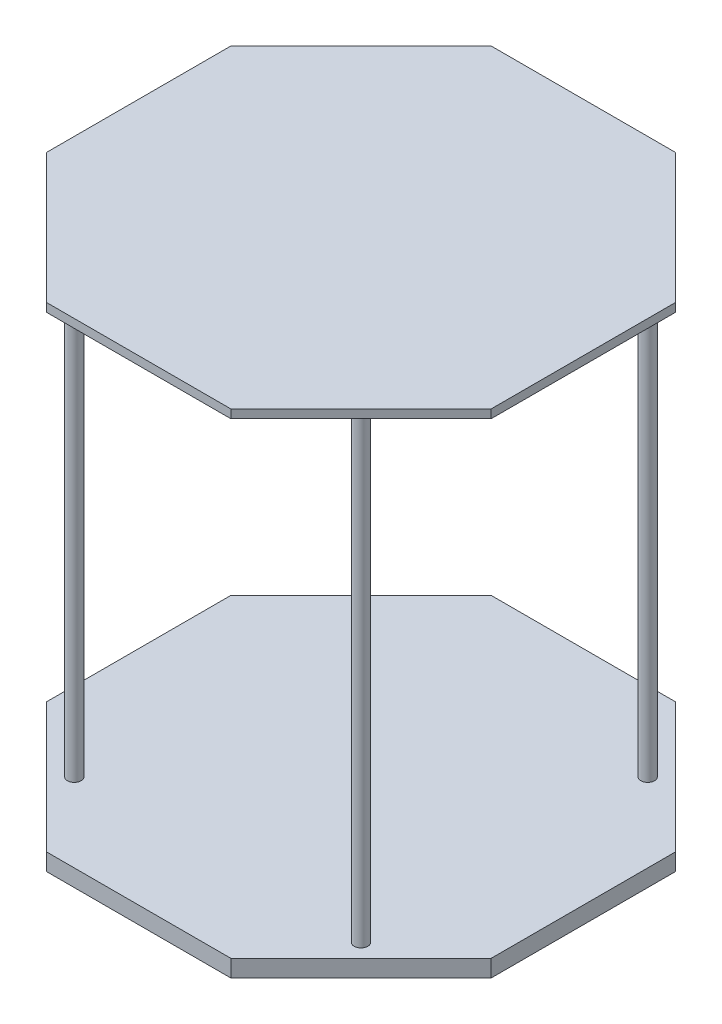
from build123d import *

# Parameters (mm, degrees)
BOSS_EXTRUDE1_DEPTH = 6.35
SKETCH2_R           = 2.54
BOSS_EXTRUDE2_DEPTH = 173.863
BOSS_EXTRUDE3_DEPTH = 3.175


with BuildPart() as part:
    # Sketch1 → Boss-Extrude1 (new body)
    with BuildSketch(Plane(origin=(0, 0, 0), x_dir=(1, 0, 0), z_dir=(0, 1, 0))):
        Polygon((34.248980878, -82.684354133), (82.684354133, -34.248980878), (82.684354133, 34.248980878), (34.248980878, 82.684354133), (-34.248980878, 82.684354133), (-82.684354133, 34.248980878), (-82.684354133, -34.248980878), (-34.248980878, -82.684354133), align=None)
    extrude(amount=BOSS_EXTRUDE1_DEPTH)

    # Sketch2 → Boss-Extrude2 (add)
    with BuildSketch(Plane(origin=(0, 6.35, 0), x_dir=(1, 0, 0), z_dir=(0, 1, 0))):
        with Locations((53.34, 53.34)):
            Circle(SKETCH2_R)
        with Locations((-53.34, 53.34)):
            Circle(SKETCH2_R)
        with Locations((53.34, -53.34)):
            Circle(SKETCH2_R)
        with Locations((-53.34, -53.34)):
            Circle(SKETCH2_R)
    extrude(amount=BOSS_EXTRUDE2_DEPTH)

    # Sketch3 → Boss-Extrude3 (add)
    with BuildSketch(Plane(origin=(0, 180.213, 0), x_dir=(1, 0, 0), z_dir=(0, 1, 0))):
        Polygon((82.684354133, -34.248980878), (82.684354133, 34.248980878), (34.248980878, 82.684354133), (-34.248980878, 82.684354133), (-82.684354133, 34.248980878), (-82.684354133, -34.248980878), (-34.248980878, -82.684354133), (34.248980878, -82.684354133), align=None)
    extrude(amount=BOSS_EXTRUDE3_DEPTH)


solid = part.part
